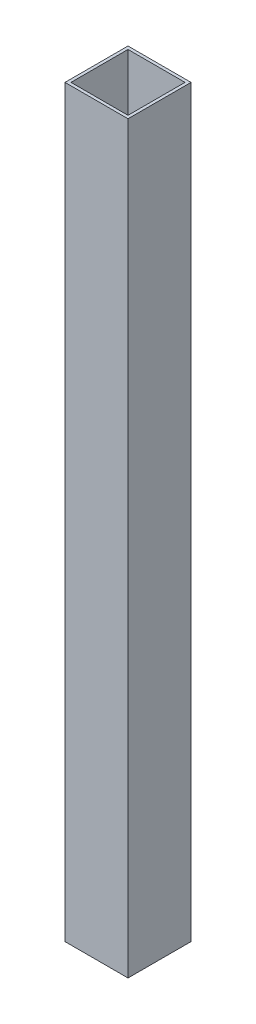
from build123d import *

# Parameters (mm, degrees)
SKETCH2_W           = 25.4
SKETCH2_H           = 25.4
SKETCH2_W_2         = 23
SKETCH2_H_2         = 23
BOSS_EXTRUDE1_DEPTH = 150


with BuildPart() as part:
    # Sketch2 → Boss-Extrude1 (new, symmetric)
    with BuildSketch(Plane(origin=(0, 0, 0), x_dir=(1, 0, 0), z_dir=(0, 1, 0))):
        Rectangle(SKETCH2_W, SKETCH2_H)
        Rectangle(SKETCH2_W_2, SKETCH2_H_2, mode=Mode.SUBTRACT)
    extrude(amount=BOSS_EXTRUDE1_DEPTH, both=True)


solid = part.part
